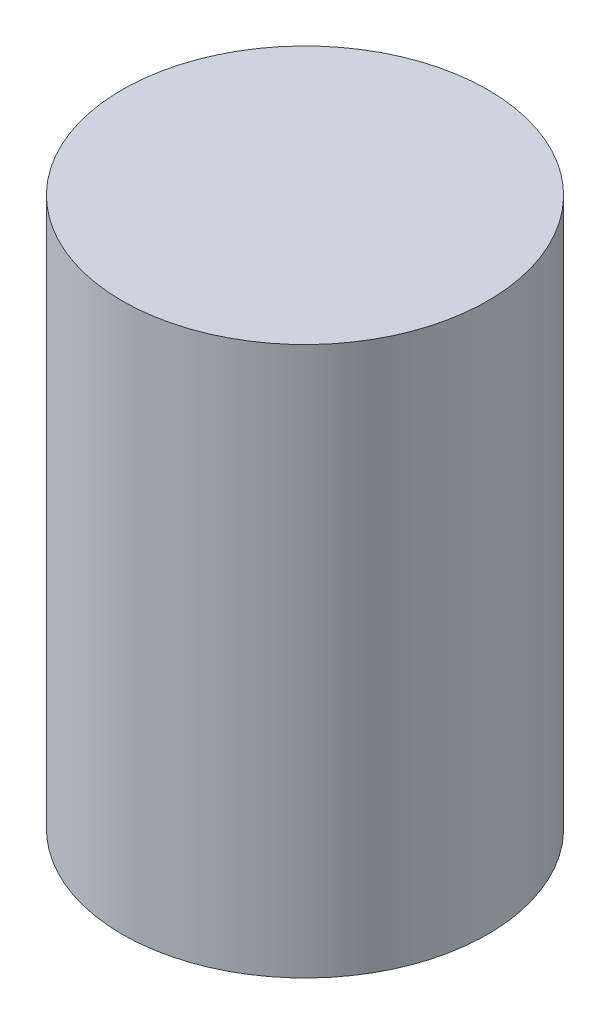
from build123d import *

# Parameters (mm, degrees)
SKETCH1_R           = 20
BOSS_EXTRUDE1_DEPTH = 60


with BuildPart() as part:
    # Sketch1 → Boss-Extrude1 (new body)
    with BuildSketch(Plane(origin=(0, 0, 0), x_dir=(1, 0, 0), z_dir=(0, 1, 0))):
        with Locations(Location((0, 0, 0), (0, 0, 270))):
            Circle(SKETCH1_R)
    extrude(amount=BOSS_EXTRUDE1_DEPTH)


solid = part.part
